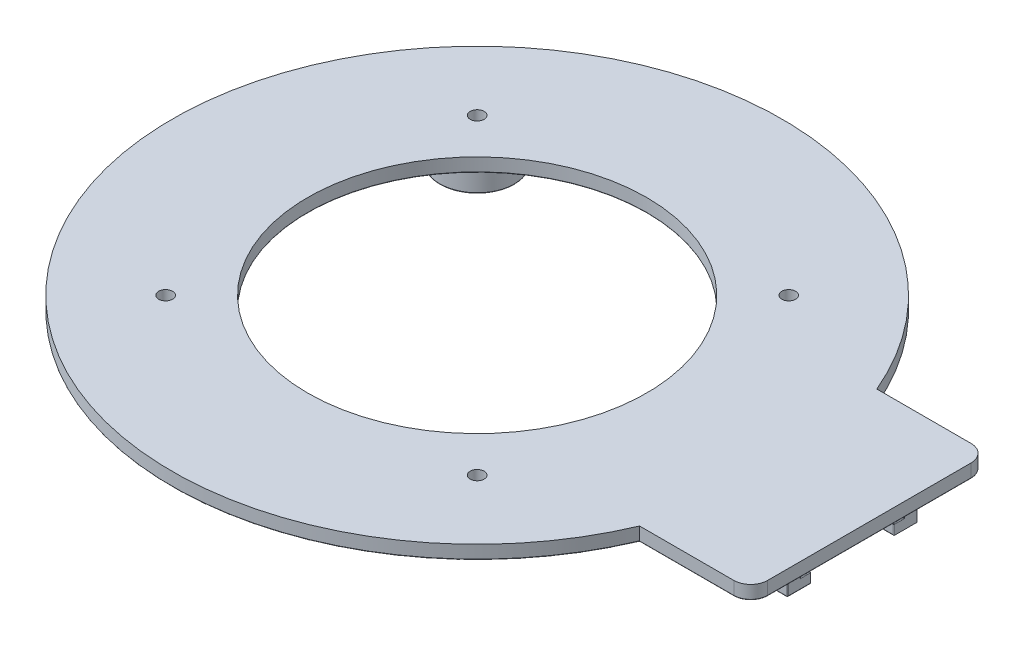
from build123d import *

# Parameters (mm, degrees)
EXTRUDE_1_DEPTH     = 4
EXTRUDE_2_DEPTH     = 30
CUT_EXTRUDE_1_REACH = 148.818
SKETCH_4_R          = 2.05
SKETCH_5_R          = 11
SKETCH_5_R_2        = 8
EXTRUDE_1_2_DEPTH   = 8.2
FILLET_1_R          = 0.2


with BuildPart() as part:
    # 草图1 → Extrude 1 (new body)
    with BuildSketch(Plane(origin=(0, 0, 0), x_dir=(1, 0, 0), z_dir=(0, 1, 0))):
        with BuildLine():
            ThreePointArc((35.707142143, -35), (-50, 0), (35.707142143, 35))
            Line((35.707142143, 35), (82.915619759, 35))
            ThreePointArc((82.915619759, 35), (-90, 0), (82.915619759, -35))
            Line((82.915619759, -35), (35.707142143, -35))
        make_face()
        with BuildLine():
            Line((82.915619759, 35), (35.707142143, 35))
            ThreePointArc((35.707142143, 35), (46.289075964, 18.902948088), (50, 0))
            Line((50, 0), (90, 0))
            ThreePointArc((90, 0), (88.211126788, 17.85489039), (82.915619759, 35))
        make_face()
        with BuildLine():
            Line((110.707142143, 35), (82.915619759, 35))
            ThreePointArc((82.915619759, 35), (88.211126788, 17.85489039), (90, 0))
            Line((90, 0), (115.707142143, 0))
            Line((115.707142143, 0), (115.707142143, 30))
            ThreePointArc((115.707142143, 30), (114.242676049, 33.535533906), (110.707142143, 35))
        make_face()
        with BuildLine():
            Line((115.707142143, 0), (90, 0))
            ThreePointArc((90, 0), (88.211126788, -17.85489039), (82.915619759, -35))
            Line((82.915619759, -35), (110.707142143, -35))
            ThreePointArc((110.707142143, -35), (114.242676049, -33.535533906), (115.707142143, -30))
            Line((115.707142143, -30), (115.707142143, 0))
        make_face()
        with BuildLine():
            Line((90, 0), (50, 0))
            ThreePointArc((50, 0), (46.289075964, -18.902948088), (35.707142143, -35))
            Line((35.707142143, -35), (82.915619759, -35))
            ThreePointArc((82.915619759, -35), (88.211126788, -17.85489039), (90, 0))
        make_face()
    extrude(amount=EXTRUDE_1_DEPTH)

    # 草图3 → 凸台-拉伸2 (add)
    with BuildSketch(Plane(origin=(110.707142143, 0, 0), x_dir=(0, 0, -1), z_dir=(1, 0, 0))):
        Polygon((-19.2, 0), (-19.2, -8.2), (-12.2, -8.2), (-12.2, -5.2), (-15.2, -5.2), (-15.2, 0), align=None)
        Polygon((19.2, -8.2), (19.2, 0), (15.2, 0), (15.2, -5.2), (12.2, -5.2), (12.2, -8.2), align=None)
    extrude(amount=-EXTRUDE_2_DEPTH)

    # 草图4 → 切除-拉伸1 (cut, up to next)
    with BuildSketch(Plane.XZ, mode=Mode.PRIVATE) as cut_extrude_1_sk1:
        with Locations(Location((45.961940777, -45.961940777, 0), (0, 0, 270))):
            Circle(SKETCH_4_R)
    cut_extrude_1_tool1 = extrude(cut_extrude_1_sk1.sketch, amount=-CUT_EXTRUDE_1_REACH, mode=Mode.PRIVATE) & part.part
    # 草图4 → 切除-拉伸1 (cut, up to next)
    with BuildSketch(Plane.XZ, mode=Mode.PRIVATE) as cut_extrude_1_sk2:
        with Locations(Location((45.961940777, 45.961940777, 0), (0, 0, 270))):
            Circle(SKETCH_4_R)
    cut_extrude_1_tool2 = extrude(cut_extrude_1_sk2.sketch, amount=-CUT_EXTRUDE_1_REACH, mode=Mode.PRIVATE) & part.part
    # 草图4 → 切除-拉伸1 (cut, up to next)
    with BuildSketch(Plane.XZ, mode=Mode.PRIVATE) as cut_extrude_1_sk3:
        with Locations(Location((-45.961940777, 45.961940777, 0), (0, 0, 270))):
            Circle(SKETCH_4_R)
    cut_extrude_1_tool3 = extrude(cut_extrude_1_sk3.sketch, amount=-CUT_EXTRUDE_1_REACH, mode=Mode.PRIVATE) & part.part
    # 草图4 → 切除-拉伸1 (cut, up to next)
    with BuildSketch(Plane.XZ, mode=Mode.PRIVATE) as cut_extrude_1_sk4:
        with Locations(Location((-45.961940777, -45.961940777, 0), (0, 0, 270))):
            Circle(SKETCH_4_R)
    cut_extrude_1_tool4 = extrude(cut_extrude_1_sk4.sketch, amount=-CUT_EXTRUDE_1_REACH, mode=Mode.PRIVATE) & part.part
    add(cut_extrude_1_tool1.solids().sort_by_distance((45.961941, 0, -45.961941))[0], mode=Mode.SUBTRACT)
    add(cut_extrude_1_tool2.solids().sort_by_distance((45.961941, 0, 45.961941))[0], mode=Mode.SUBTRACT)
    add(cut_extrude_1_tool3.solids().sort_by_distance((-45.961941, 0, 45.961941))[0], mode=Mode.SUBTRACT)
    add(cut_extrude_1_tool4.solids().sort_by_distance((-45.961941, 0, -45.961941))[0], mode=Mode.SUBTRACT)

    # 草图5 → Extrude 1 2 (add)
    # profile 1 of 4: a face of its own
    with BuildSketch(Plane.XZ):
        with Locations((45.961940777, 45.961940777)):
            Circle(SKETCH_5_R)
        with Locations((45.961940777, 45.961940777)):
            Circle(SKETCH_5_R_2, mode=Mode.SUBTRACT)
    # profile 2 of 4: a face of its own
    with BuildSketch(Plane.XZ):
        with Locations((45.961940777, -45.961940777)):
            Circle(SKETCH_5_R)
        with Locations((45.961940777, -45.961940777)):
            Circle(SKETCH_5_R_2, mode=Mode.SUBTRACT)
    # profile 3 of 4: a face of its own
    with BuildSketch(Plane.XZ):
        with Locations((-45.961940777, -45.961940777)):
            Circle(SKETCH_5_R)
        with Locations((-45.961940777, -45.961940777)):
            Circle(SKETCH_5_R_2, mode=Mode.SUBTRACT)
    # profile 4 of 4: a face of its own
    with BuildSketch(Plane.XZ):
        with Locations((-45.961940777, 45.961940777)):
            Circle(SKETCH_5_R)
        with Locations((-45.961940777, 45.961940777)):
            Circle(SKETCH_5_R_2, mode=Mode.SUBTRACT)
    extrude(amount=EXTRUDE_1_2_DEPTH)

    # 圆角1
    fillet_1_edges = [part.edges().sort_by_distance(p)[0] for p in [
        (96.811380951, 0, -35),
        (114.242676049, 0, 33.535533906),
        (80.707142143, -5.2, 13.7),
        (80.707142143, -5.2, -13.7),
        (-35.707142143, 0, 35),
        (80.707142143, -2.6, -15.2),
        (80.707142143, -2.6, 15.2),
        (80.707142143, -4.1, -19.2),
        (80.707142143, -6.7, 12.2),
        (95.707142143, -5.2, 12.2),
        (80.707142143, -4.1, 19.2),
        (95.707142143, -5.2, -12.2),
        (80.707142143, -6.7, -12.2),
        (95.707142143, -8.2, -19.2),
        (95.707142143, -8.2, -12.2),
        (80.707142143, -8.2, -15.7),
        (80.707142143, -8.2, 15.7),
        (37.961940777, -8.2, 45.961940777),
        (-53.961940777, -8.2, 45.961940777),
        (34.961940777, -8.2, -45.961940777),
        (37.961940777, -8.2, -45.961940777),
        (-53.961940777, -8.2, -45.961940777),
        (-56.961940777, -8.2, -45.961940777),
        (-56.961940777, -8.2, 45.961940777),
        (34.961940777, -8.2, 45.961940777),
        (110.707142143, -4.1, 19.2),
        (95.707142143, -8.2, 19.2),
        (110.707142143, -8.2, 15.7),
        (110.707142143, -6.7, 12.2),
        (110.707142143, -2.6, 15.2),
        (110.707142143, -5.2, 13.7),
        (110.707142143, -5.2, -13.7),
        (110.707142143, -6.7, -12.2),
        (110.707142143, -2.6, -15.2),
        (95.707142143, -8.2, 12.2),
        (110.707142143, -4.1, -19.2),
        (114.242676049, 0, -33.535533906),
        (115.707142143, 0, 0),
        (96.811380951, 0, 35),
        (-90, 0, 0),
    ]]
    fillet(fillet_1_edges, radius=FILLET_1_R)


solid = part.part
